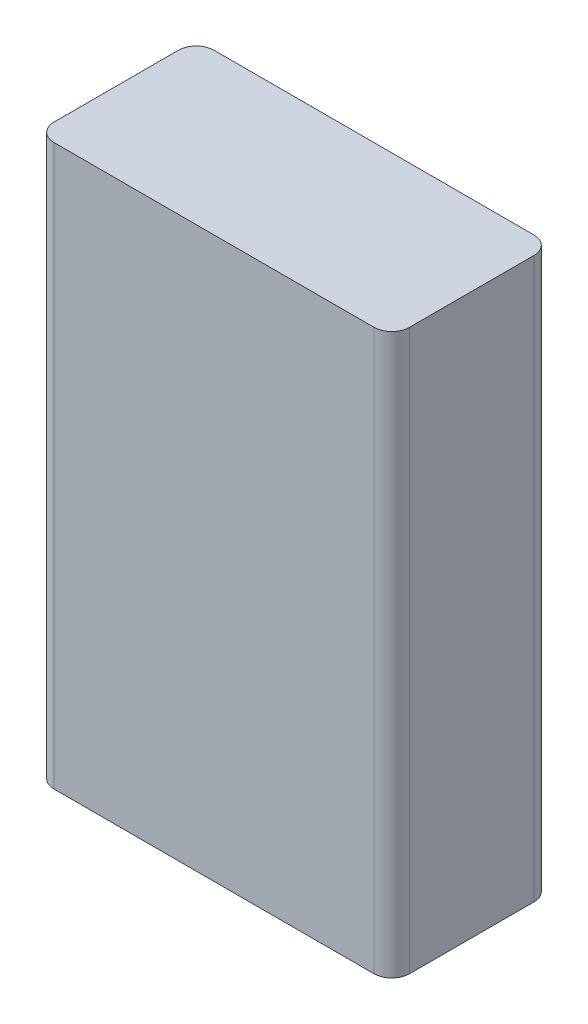
from build123d import *

# Parameters (mm, degrees)
SKETCH_1_W         = 40
SKETCH_1_H         = 63
BLOCKEXTRUDE_DEPTH = 18
FILLET_2_R         = 2


with BuildPart() as part:
    # 草图1 → BlockExtrude (new body)
    with BuildSketch(Plane.XY):
        with Locations((20, 31.5)):
            Rectangle(SKETCH_1_W, SKETCH_1_H)
    extrude(amount=BLOCKEXTRUDE_DEPTH)

    # Fillet 2
    fillet_2_edges = [part.edges().sort_by_distance(p)[0] for p in [
        (40, 31.5, 18),
        (0, 31.5, 18),
        (40, 31.5, 0),
        (0, 31.5, 0),
    ]]
    fillet(fillet_2_edges, radius=FILLET_2_R)


solid = part.part
